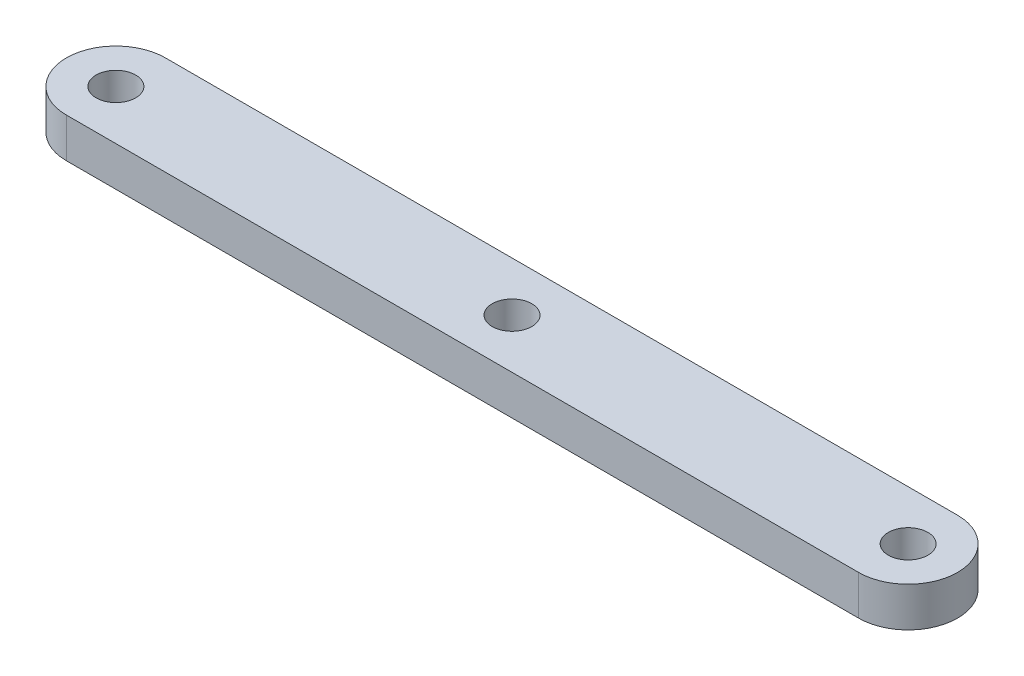
from build123d import *

# Parameters (mm, degrees)
SKETCH1_R           = 1
BOSS_EXTRUDE1_DEPTH = 2


with BuildPart() as part:
    # Sketch1 → Boss-Extrude1 (new body)
    with BuildSketch(Plane(origin=(0, 0, 0), x_dir=(1, 0, 0), z_dir=(0, 1, 0))):
        with BuildLine():
            Line((-20, 2.5), (20, 2.5))
            ThreePointArc((20, 2.5), (22.5, 0), (20, -2.5))
            Line((20, -2.5), (-20, -2.5))
            ThreePointArc((-20, -2.5), (-22.5, 0), (-20, 2.5))
        make_face()
        with Locations(Location((20, 0, 0), (0, 0, 270))):
            Circle(SKETCH1_R, mode=Mode.SUBTRACT)
        with Locations(Location((-20, 0, 0), (0, 0, 270))):
            Circle(SKETCH1_R, mode=Mode.SUBTRACT)
        with Locations(Location((0, 0, 0), (0, 0, 270))):
            Circle(SKETCH1_R, mode=Mode.SUBTRACT)
    extrude(amount=BOSS_EXTRUDE1_DEPTH)


solid = part.part
